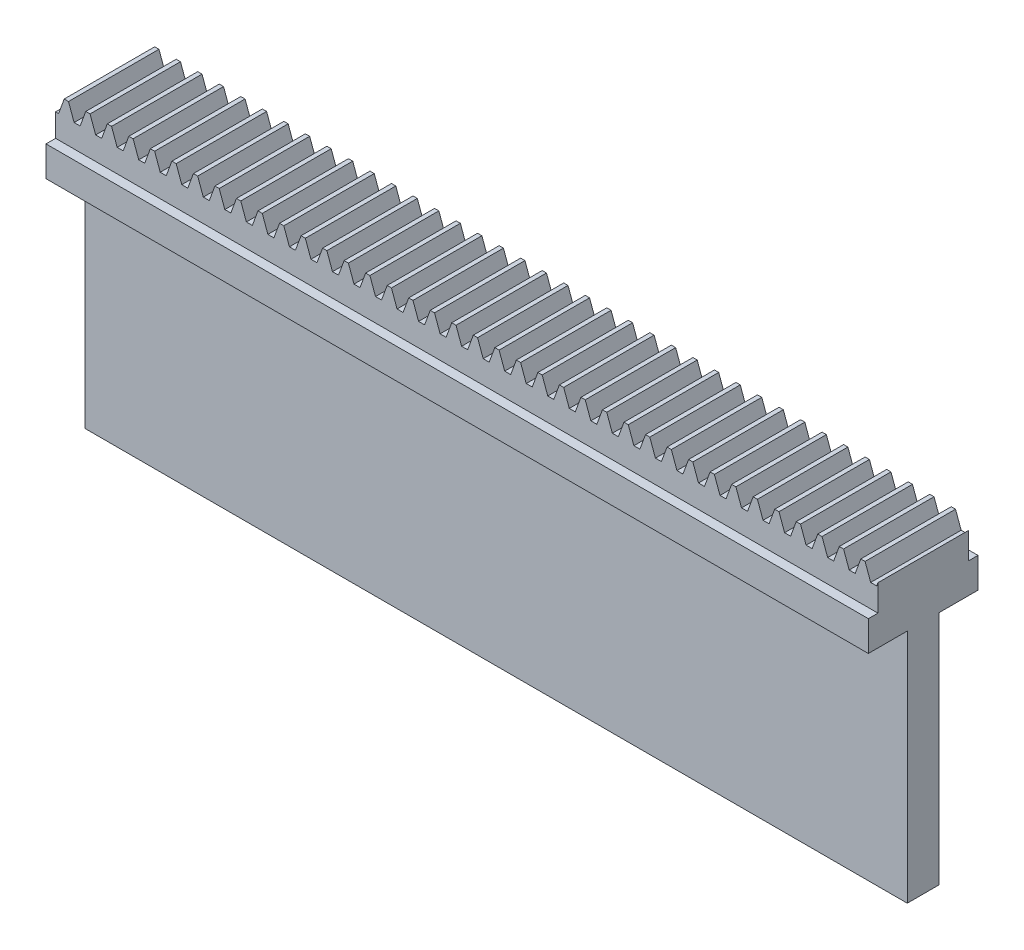
from build123d import *

# Parameters (mm, degrees)
BLANKSKE_W              = 150
BLANKSKE_H              = 12.5
BLANK_DEPTH             = 20
TOOTHCUTSIM_DEPTH       = 152.842846391
TEETHCUTS_COUNT         = 39
TEETHCUTS_PITCH         = 3.926990813
CROQUIS3_W              = 150.577281711
CROQUIS3_H              = 7.352719699
CORTAR_EXTRUIR1_DEPTH   = 1.75
CROQUIS4_W              = 150
CROQUIS4_H              = 8.901496228
CORTAR_EXTRUIR2_DEPTH   = 1.75
CROQUIS6_W              = 150
CROQUIS6_H              = 5.8
SALIENTE_EXTRUIR1_DEPTH = 43


with BuildPart() as part:
    # BlankSke → Blank (new body)
    with BuildSketch(Plane.XY):
        with Locations((75, 6.25)):
            Rectangle(BLANKSKE_W, BLANKSKE_H)
    extrude(amount=-BLANK_DEPTH)

    # TooCutSkeSim → ToothCutSim (cut, through all)
    with BuildSketch(Plane.XY):
        Polygon((0.548044212, 9.6875), (-0.548044212, 9.6875), (-1.58095534, 12.5254), (1.58095534, 12.5254), align=None)
    toothcutsim = extrude(amount=-TOOTHCUTSIM_DEPTH, mode=Mode.SUBTRACT)

    # TeethCuts: ToothCutSim ×39
    with Locations(*[(i * TEETHCUTS_PITCH, 0, 0) for i in range(1, TEETHCUTS_COUNT)]):
        add(toothcutsim, mode=Mode.SUBTRACT)

    # Croquis3 → Cortar-Extruir1 (cut)
    with BuildSketch(Plane.XY):
        with Locations((75.288640856, 9.17635985)):
            Rectangle(CROQUIS3_W, CROQUIS3_H)
    extrude(amount=-CORTAR_EXTRUIR1_DEPTH, mode=Mode.SUBTRACT)

    # Croquis4 → Cortar-Extruir2 (cut)
    with BuildSketch(Plane(origin=(0, 0, -20), x_dir=(-1, 0, 0), z_dir=(0, 0, -1))):
        with Locations((-75, 9.950748114)):
            Rectangle(CROQUIS4_W, CROQUIS4_H)
    extrude(amount=-CORTAR_EXTRUIR2_DEPTH, mode=Mode.SUBTRACT)

    # Croquis6 → Saliente-Extruir1 (add)
    with BuildSketch(Plane.XZ):
        with Locations((75, -10)):
            Rectangle(CROQUIS6_W, CROQUIS6_H)
    extrude(amount=SALIENTE_EXTRUIR1_DEPTH)


solid = part.part
